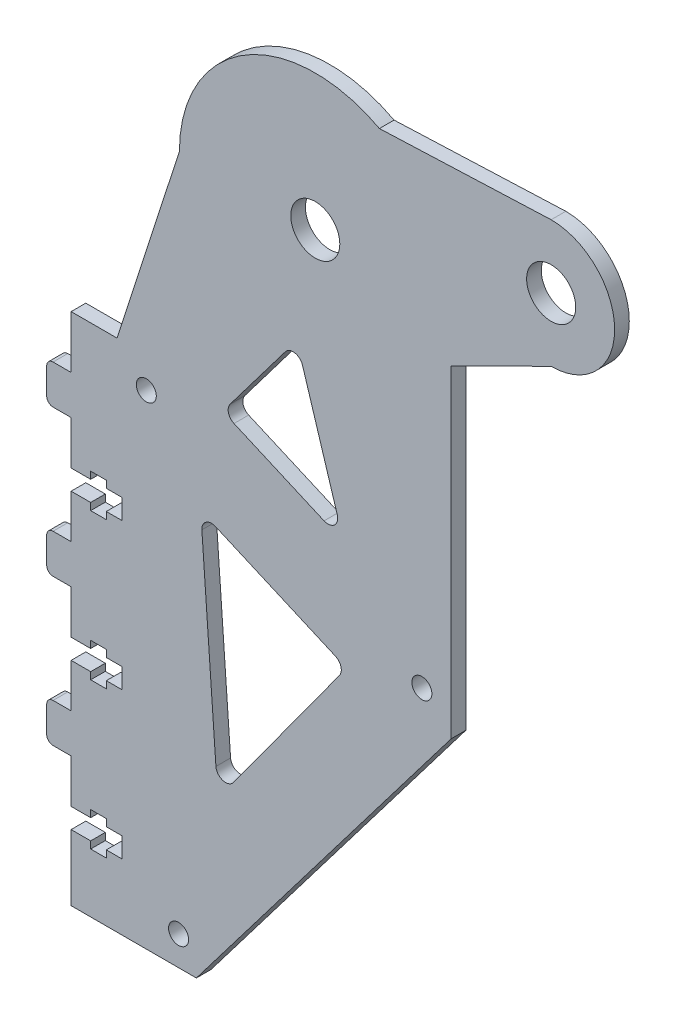
from build123d import *

# Parameters (mm, degrees)
SKETCH_1_R      = 5.0225
SKETCH_1_R_2    = 2.05
EXTRUDE_1_DEPTH = 3
FILLET_1_R      = 2
FILLET_2_R      = 1.3
EXTRUDE_START   = -3
SKETCH_3_R      = 5.025
EXTRUDE_2_DEPTH = 3


with BuildPart() as part:
    # 草图1 → 凸台-拉伸1 (new body)
    with BuildSketch(Plane.XY):
        with BuildLine():
            Line((298.545628784, -83.894391363), (298.545628784, -92.841778663))
            Line((298.545628784, -92.841778663), (302.545628784, -92.841778663))
            Line((302.545628784, -92.841778663), (302.545628784, -91.391778663))
            Line((302.545628784, -91.391778663), (305.745628784, -91.391778663))
            Line((305.745628784, -91.391778663), (305.745628784, -92.841778663))
            Line((305.745628784, -92.841778663), (308.945628784, -92.841778663))
            Line((308.945628784, -92.841778663), (308.945628784, -96.941778663))
            Line((308.945628784, -96.941778663), (305.745628784, -96.941778663))
            Line((305.745628784, -96.941778663), (305.745628784, -98.391778663))
            Line((305.745628784, -98.391778663), (302.545628784, -98.391778663))
            Line((302.545628784, -98.391778663), (302.545628784, -96.941778663))
            Line((302.545628784, -96.941778663), (298.545628784, -96.941778663))
            Line((298.545628784, -96.941778663), (298.545628784, -105.894391358))
            Line((298.545628784, -105.894391358), (293.545628784, -105.894391358))
            Line((293.545628784, -105.894391358), (293.545628784, -113.894391358))
            Line((293.545628784, -113.894391358), (298.545628784, -113.894391358))
            Line((298.545628784, -113.894391358), (298.545628784, -122.847004054))
            Line((298.545628784, -122.847004054), (302.545628784, -122.847004054))
            Line((302.545628784, -122.847004054), (302.545628784, -121.397004054))
            Line((302.545628784, -121.397004054), (305.745628784, -121.397004054))
            Line((305.745628784, -121.397004054), (305.745628784, -122.847004054))
            Line((305.745628784, -122.847004054), (308.945628784, -122.847004054))
            Line((308.945628784, -122.847004054), (308.945628784, -126.947004054))
            Line((308.945628784, -126.947004054), (305.745628784, -126.947004054))
            Line((305.745628784, -126.947004054), (305.745628784, -128.397004054))
            Line((305.745628784, -128.397004054), (302.545628784, -128.397004054))
            Line((302.545628784, -128.397004054), (302.545628784, -126.947004054))
            Line((302.545628784, -126.947004054), (298.545628784, -126.947004054))
            Line((298.545628784, -126.947004054), (298.545628784, -140.447004054))
            Line((298.545628784, -140.447004054), (324.188862368, -140.447004054))
            Line((324.188862368, -140.447004054), (376.358604426, -71.946984141))
            Line((376.358604426, -71.946984141), (376.358604426, 4.396201153))
            ThreePointArc((376.358604426, 4.396201153), (348.536987634, 32.217817945), (320.715370843, 4.396201153))
            Line((320.715370843, 4.396201153), (307.936987634, -35.096984141))
            Line((307.936987634, -35.096984141), (298.545628784, -35.096984141))
            Line((298.545628784, -35.096984141), (298.545628784, -45.889165972))
            Line((298.545628784, -45.889165972), (293.545628784, -45.889165972))
            Line((293.545628784, -45.889165972), (293.545628784, -53.889165972))
            Line((293.545628784, -53.889165972), (298.545628784, -53.889165972))
            Line((298.545628784, -53.889165972), (298.545628784, -62.841778668))
            Line((298.545628784, -62.841778668), (302.545628784, -62.841778668))
            Line((302.545628784, -62.841778668), (302.545628784, -61.391778668))
            Line((302.545628784, -61.391778668), (305.745628784, -61.391778668))
            Line((305.745628784, -61.391778668), (305.745628784, -62.841778668))
            Line((305.745628784, -62.841778668), (308.945628784, -62.841778668))
            Line((308.945628784, -62.841778668), (308.945628784, -66.941778668))
            Line((308.945628784, -66.941778668), (305.745628784, -66.941778668))
            Line((305.745628784, -66.941778668), (305.745628784, -68.391778668))
            Line((305.745628784, -68.391778668), (302.545628784, -68.391778668))
            Line((302.545628784, -68.391778668), (302.545628784, -66.941778668))
            Line((302.545628784, -66.941778668), (298.545628784, -66.941778668))
            Line((298.545628784, -66.941778668), (298.545628784, -75.894391363))
            Line((298.545628784, -75.894391363), (293.545628784, -75.894391363))
            Line((293.545628784, -75.894391363), (293.545628784, -83.894391363))
            Line((293.545628784, -83.894391363), (298.545628784, -83.894391363))
        make_face()
        with Locations((348.536987634, 4.396201153)):
            Circle(SKETCH_1_R, mode=Mode.SUBTRACT)
        with Locations((320.545628784, -134.447004054)):
            Circle(SKETCH_1_R_2, mode=Mode.SUBTRACT)
        with Locations((370.358604426, -65.946984141)):
            Circle(SKETCH_1_R_2, mode=Mode.SUBTRACT)
        with Locations((313.936987634, -41.346984141)):
            Circle(SKETCH_1_R_2, mode=Mode.SUBTRACT)
        Polygon((354.947285032, -70.136765586), (328.579617375, -106.396108383), (325.08144343, -57.115165973), align=None, mode=Mode.SUBTRACT)
        Polygon((329.571126451, -37.254352656), (354.337315751, -48.052488042), (344.758747766, -17.175445836), align=None, mode=Mode.SUBTRACT)
    extrude(amount=EXTRUDE_1_DEPTH)

    # 圆角1
    fillet_1_edges = [part.edges().sort_by_distance(p)[0] for p in [
        (354.947285032, -70.136765586, 1.5),
        (325.08144343, -57.115165973, 1.5),
        (328.579617375, -106.396108383, 1.5),
        (344.758747766, -17.175445836, 1.5),
        (329.571126451, -37.254352656, 1.5),
        (354.337315751, -48.052488042, 1.5),
    ]]
    fillet(fillet_1_edges, radius=FILLET_1_R)

    # 圆角2
    fillet_2_edges = [part.edges().sort_by_distance(p)[0] for p in [
        (293.545628784, -113.894391358, 1.5),
        (293.545628784, -105.894391358, 1.5),
        (293.545628784, -83.894391363, 1.5),
        (293.545628784, -75.894391363, 1.5),
        (293.545628784, -53.889165972, 1.5),
        (293.545628784, -45.889165972, 1.5),
    ]]
    fillet(fillet_2_edges, radius=FILLET_2_R)

    # 草图3 → 凸台-拉伸2 (add)
    with BuildSketch(Plane(origin=(0, 0, 0), x_dir=(-1, 0, 0), z_dir=(0, 0, -1)).offset(EXTRUDE_START)):
        with BuildLine():
            Line((-348.536987634, 28.396201153), (-396.833278949, 30.337153408))
            ThreePointArc((-396.833278949, 30.337153408), (-409.833278949, 17.337153408), (-396.833278949, 4.337153408))
            Line((-396.833278949, 4.337153408), (-348.536987634, -19.603798847))
            Line((-348.536987634, -19.603798847), (-372.536987634, 4.396201153))
            Line((-372.536987634, 4.396201153), (-348.536987634, 28.396201153))
        make_face()
        with Locations((-396.833278949, 17.337153408)):
            Circle(SKETCH_3_R, mode=Mode.SUBTRACT)
    extrude(amount=EXTRUDE_2_DEPTH)


solid = part.part
